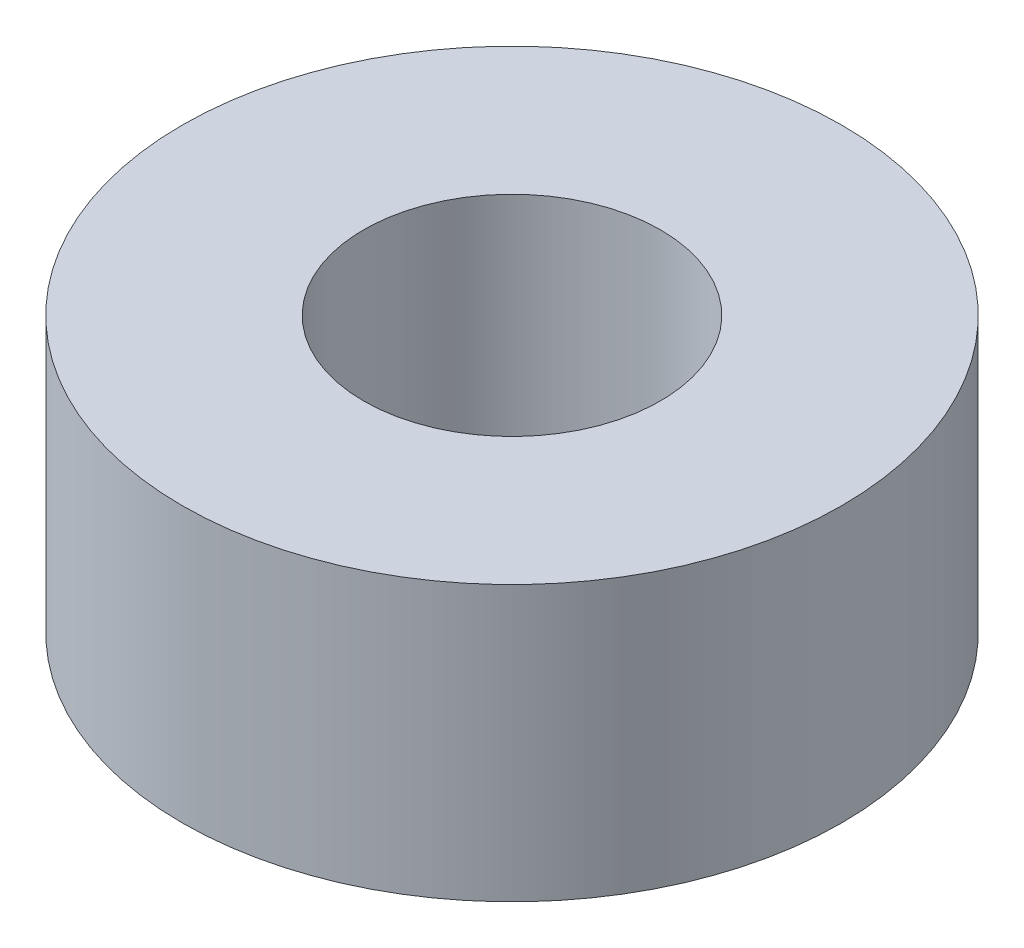
from build123d import *

# Parameters (mm, degrees)
SKETCH1_R           = 3
SKETCH1_R_2         = 1.35
BOSS_EXTRUDE1_DEPTH = 2.5


with BuildPart() as part:
    # Sketch1 → Boss-Extrude1 (new body)
    with BuildSketch(Plane(origin=(0, 0, 0), x_dir=(1, 0, 0), z_dir=(0, 1, 0))):
        with Locations(Location((0, 0, 0), (0, 0, 270))):
            Circle(SKETCH1_R)
        with Locations(Location((0, 0, 0), (0, 0, 270))):
            Circle(SKETCH1_R_2, mode=Mode.SUBTRACT)
    extrude(amount=BOSS_EXTRUDE1_DEPTH)


solid = part.part
